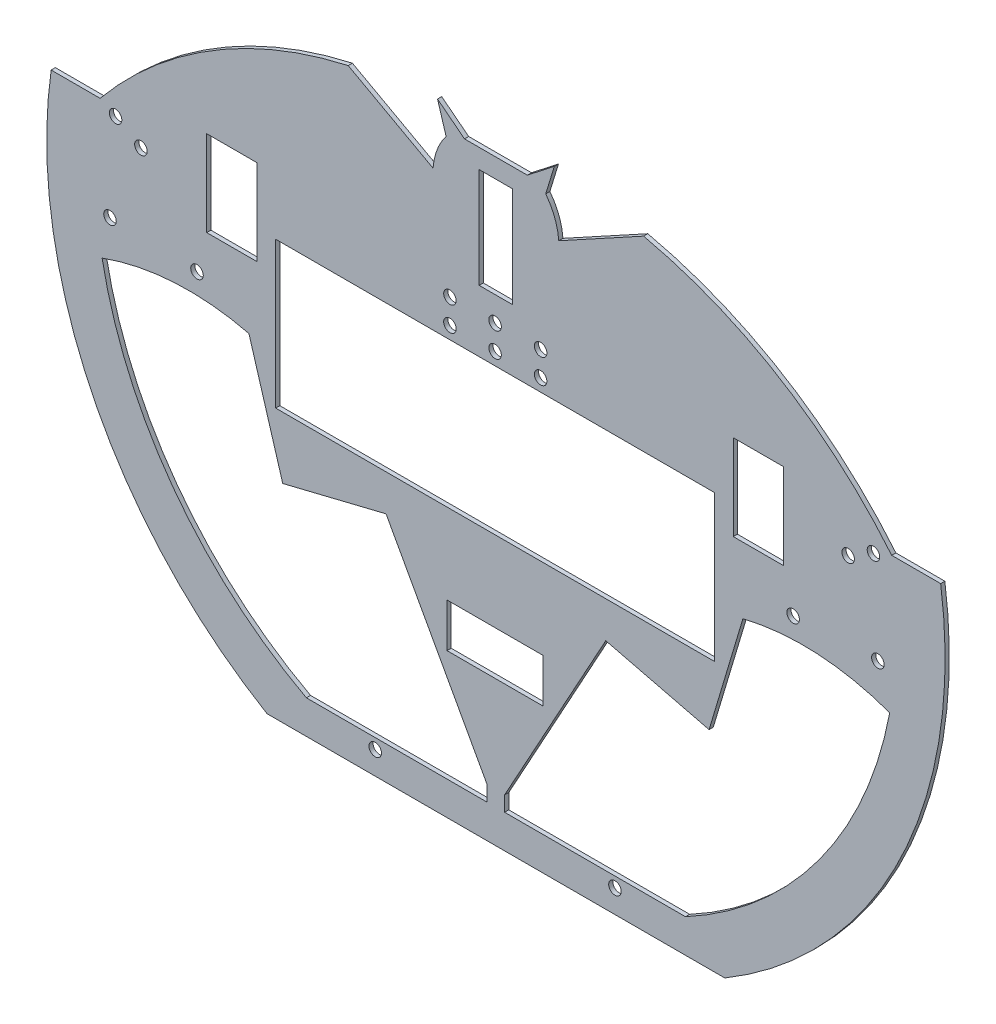
from build123d import *

# Parameters (mm, degrees)
CROQUIS1_R              = 1.5
CROQUIS1_W              = 23
CROQUIS1_H              = 10.5
CROQUIS1_W_2            = 12
CROQUIS1_H_2            = 20.5
CROQUIS1_W_3            = 8
CROQUIS1_H_3            = 24
CROQUIS1_W_4            = 105
CROQUIS1_H_4            = 35
SALIENTE_EXTRUIR1_DEPTH = 1


with BuildPart() as part:
    # Croquis1 → Saliente-Extruir1 (new body)
    with BuildSketch(Plane.XY):
        with BuildLine():
            Line((-1537.163110479, -136.766453489), (-1516.853146696, -125.6542904))
            ThreePointArc((-1516.853146696, -125.6542904), (-1484.11625712, -138.920059749), (-1457.482039397, -162.121417938))
            Line((-1457.482039397, -162.121417938), (-1445.993940748, -162.121417938))
            Line((-1445.993940748, -162.121417938), (-1445.762202271, -162.121417938))
            ThreePointArc((-1445.762202271, -162.121417938), (-1455.297709344, -223.734904974), (-1497.428135695, -269.693308507))
            Line((-1497.428135695, -269.693308507), (-1552.200391445, -269.693308507))
            Line((-1552.200391445, -269.693308507), (-1606.972647196, -269.693308507))
            ThreePointArc((-1606.972647196, -269.693308507), (-1649.103073546, -223.734904974), (-1658.638580619, -162.121417938))
            Line((-1658.638580619, -162.121417938), (-1646.918743493, -162.121417938))
            ThreePointArc((-1646.918743493, -162.121417938), (-1620.284525771, -138.920059749), (-1587.547636195, -125.6542904))
            Line((-1587.547636195, -125.6542904), (-1567.237672411, -136.766453489))
            ThreePointArc((-1567.237672411, -136.766453489), (-1566.281329143, -132.459607123), (-1564.119167026, -128.614015745))
            Line((-1564.119167026, -128.614015745), (-1566.175134815, -121.889248119))
            Line((-1566.175134815, -121.889248119), (-1559.719031928, -126.933308507))
            Line((-1559.719031928, -126.933308507), (-1544.681750962, -126.933308507))
            Line((-1544.681750962, -126.933308507), (-1538.225648075, -121.889248119))
            Line((-1538.225648075, -121.889248119), (-1540.281615865, -128.614015745))
            ThreePointArc((-1540.281615865, -128.614015745), (-1538.119453748, -132.459607123), (-1537.163110479, -136.766453489))
        make_face()
        with Locations((-1523.716235661, -264.175855838)):
            Circle(CROQUIS1_R, mode=Mode.SUBTRACT)
        with Locations((-1644.551864676, -185.675855838)):
            Circle(CROQUIS1_R, mode=Mode.SUBTRACT)
        with Locations((-1541.502776276, -167.322485879)):
            Circle(CROQUIS1_R, mode=Mode.SUBTRACT)
        with Locations((-1552.400156362, -167.322485879)):
            Circle(CROQUIS1_R, mode=Mode.SUBTRACT)
        with Locations((-1563.201766149, -167.322485879)):
            Circle(CROQUIS1_R, mode=Mode.SUBTRACT)
        with Locations((-1552.400156362, -161.472485879)):
            Circle(CROQUIS1_R, mode=Mode.SUBTRACT)
        with Locations((-1460.786663592, -185.675855838)):
            Circle(CROQUIS1_R, mode=Mode.SUBTRACT)
        with Locations((-1461.847779246, -163.902354835)):
            Circle(CROQUIS1_R, mode=Mode.SUBTRACT)
        with Locations((-1643.220327484, -164.014915474)):
            Circle(CROQUIS1_R, mode=Mode.SUBTRACT)
        with Locations((-1563.201766149, -161.472485879)):
            Circle(CROQUIS1_R, mode=Mode.SUBTRACT)
        with Locations((-1541.502776276, -161.472485879)):
            Circle(CROQUIS1_R, mode=Mode.SUBTRACT)
        with Locations((-1581.083835661, -264.175855838)):
            Circle(CROQUIS1_R, mode=Mode.SUBTRACT)
        with Locations((-1637.158149658, -167.514915474)):
            Circle(CROQUIS1_R, mode=Mode.SUBTRACT)
        with Locations((-1467.909957073, -167.402354835)):
            Circle(CROQUIS1_R, mode=Mode.SUBTRACT)
        with Locations((-1623.732006953, -186.485491114)):
            Circle(CROQUIS1_R, mode=Mode.SUBTRACT)
        with Locations((-1481.067822966, -186.485491114)):
            Circle(CROQUIS1_R, mode=Mode.SUBTRACT)
        with BuildLine():
            Line((-1550.123752332, -261.693308507), (-1506.829937403, -261.693308507))
            ThreePointArc((-1506.829937403, -261.693308507), (-1474.837098768, -233.882364295), (-1457.957337533, -194.997097128))
            ThreePointArc((-1457.957337533, -194.997097128), (-1475.380705089, -191.41817703), (-1493.091376833, -193.065754767))
            Line((-1493.091376833, -193.065754767), (-1501.186287871, -220.101341452))
            Line((-1501.186287871, -220.101341452), (-1525.911955882, -214.031108862))
            Line((-1525.911955882, -214.031108862), (-1550.123752332, -258.096464053))
            Line((-1550.123752332, -258.096464053), (-1550.123752332, -261.693308507))
        make_face(mode=Mode.SUBTRACT)
        with BuildLine():
            Line((-1578.488827009, -214.031108862), (-1554.277030559, -258.096464053))
            Line((-1554.277030559, -258.096464053), (-1554.277030559, -261.693308507))
            Line((-1554.277030559, -261.693308507), (-1597.570845488, -261.693308507))
            ThreePointArc((-1597.570845488, -261.693308507), (-1629.563684123, -233.882364295), (-1646.443445358, -194.997097128))
            ThreePointArc((-1646.443445358, -194.997097128), (-1629.020077802, -191.41817703), (-1611.309406057, -193.065754767))
            Line((-1611.309406057, -193.065754767), (-1603.21449502, -220.101341452))
            Line((-1603.21449502, -220.101341452), (-1578.488827009, -214.031108862))
        make_face(mode=Mode.SUBTRACT)
        with Locations((-1552.400156362, -229.832455111)):
            Rectangle(CROQUIS1_W, CROQUIS1_H, mode=Mode.SUBTRACT)
        with Locations((-1489.400156362, -166.947886235)):
            Rectangle(CROQUIS1_W_2, CROQUIS1_H_2, mode=Mode.SUBTRACT)
        with Locations((-1615.400156362, -166.947886235)):
            Rectangle(CROQUIS1_W_2, CROQUIS1_H_2, mode=Mode.SUBTRACT)
        with Locations((-1552.200391445, -143.53903119)):
            Rectangle(CROQUIS1_W_3, CROQUIS1_H_3, mode=Mode.SUBTRACT)
        with Locations((-1552.400156362, -187.822466505)):
            Rectangle(CROQUIS1_W_4, CROQUIS1_H_4, mode=Mode.SUBTRACT)
    extrude(amount=SALIENTE_EXTRUIR1_DEPTH)


solid = part.part
